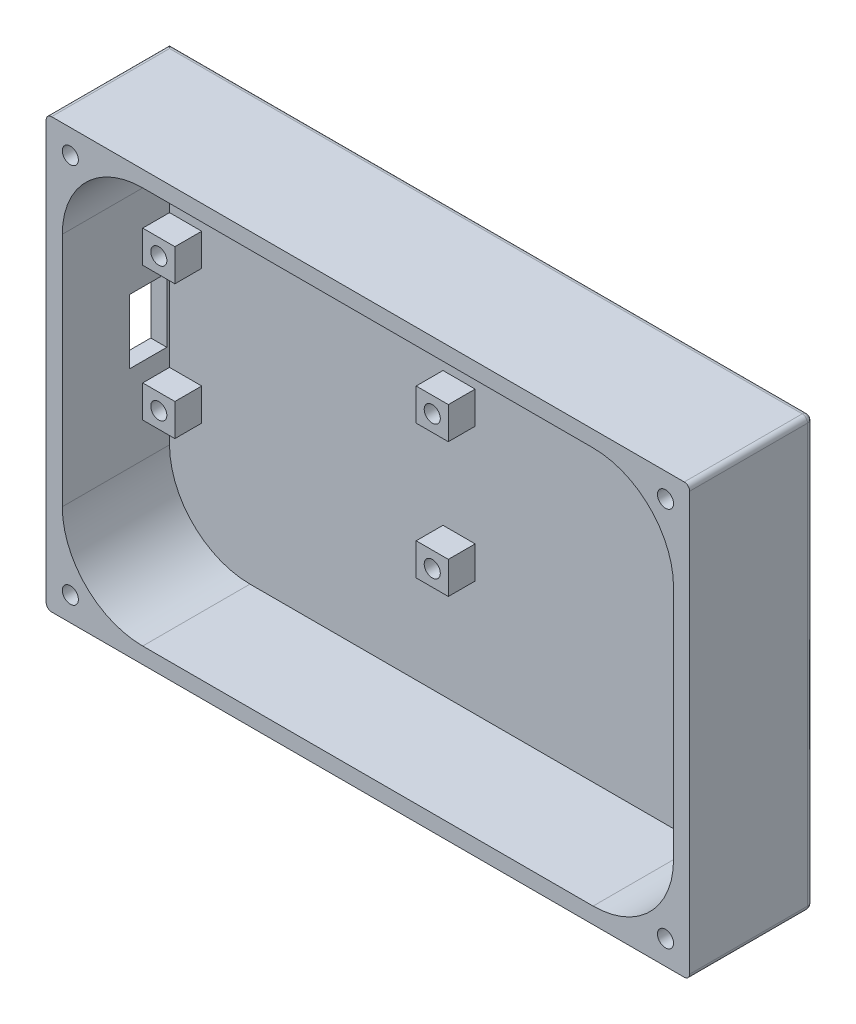
from build123d import *

# Parameters (mm, degrees)
ESQUISSE1_W             = 120
ESQUISSE1_H             = 80
BOSS_EXTRU_1_DEPTH      = 3
ESQUISSE4_W             = 120
ESQUISSE4_H             = 80
ESQUISSE4_W_2           = 114
ESQUISSE4_H_2           = 74
BOSS_EXTRU_3_DEPTH      = 20
CONG_1_R                = 15
ESQUISSE5_R             = 1.5
ENL_V_MAT_EXTRU_1_DEPTH = 147.044513762
ESQUISSE7_R             = 3
ENL_V_MAT_EXTRU_3_DEPTH = 6
ESQUISSE8_W             = 6
ESQUISSE8_H             = 6
ESQUISSE8_R             = 1.5
BOSS_EXTRU_4_DEPTH      = 5
ENL_V_MAT_EXTRU_4_REACH = 148.045
ESQUISSE9_W             = 7
ESQUISSE9_H             = 12
CONG_3_R                = 1


with BuildPart() as part:
    # Esquisse1 → Boss.-Extru.1 (new body)
    with BuildSketch(Plane.XY):
        with Locations((60, 40)):
            Rectangle(ESQUISSE1_W, ESQUISSE1_H)
    extrude(amount=BOSS_EXTRU_1_DEPTH)

    # Esquisse4 → Boss.-Extru.3 (add)
    with BuildSketch(Plane.XY.offset(3)):
        with Locations((60, 40)):
            Rectangle(ESQUISSE4_W, ESQUISSE4_H)
        with Locations((60, 40)):
            Rectangle(ESQUISSE4_W_2, ESQUISSE4_H_2, mode=Mode.SUBTRACT)
    extrude(amount=BOSS_EXTRU_3_DEPTH)

    # Congé1
    cong_1_edges = [part.edges().sort_by_distance(p)[0] for p in [
        (3, 3, 13),
        (117, 3, 13),
        (117, 77, 13),
        (3, 77, 13),
    ]]
    fillet(cong_1_edges, radius=CONG_1_R)

    # Esquisse5 → Enlèv. mat.-Extru.1 (cut, through all)
    with BuildSketch(Plane.XY.offset(23)):
        with Locations((4.5, 75.5)):
            Circle(ESQUISSE5_R)
        with Locations((115.5, 75.5)):
            Circle(ESQUISSE5_R)
        with Locations((115.5, 4.5)):
            Circle(ESQUISSE5_R)
        with Locations((4.5, 4.5)):
            Circle(ESQUISSE5_R)
    extrude(amount=-ENL_V_MAT_EXTRU_1_DEPTH, mode=Mode.SUBTRACT)

    # Esquisse7 → Enlèv. mat.-Extru.3 (cut)
    with BuildSketch(Plane(origin=(0, 0, 0), x_dir=(-1, 0, 0), z_dir=(0, 0, -1))):
        with Locations((-115.5, 75.5)):
            Circle(ESQUISSE7_R)
        with Locations((-4.5, 75.5)):
            Circle(ESQUISSE7_R)
        with Locations((-4.5, 4.5)):
            Circle(ESQUISSE7_R)
        with Locations((-115.5, 4.5)):
            Circle(ESQUISSE7_R)
    extrude(amount=-ENL_V_MAT_EXTRU_3_DEPTH, mode=Mode.SUBTRACT)

    # Esquisse8 → Boss.-Extru.4 (add)
    # profile 1 of 4: a face of its own
    with BuildSketch(Plane.XY.offset(3)):
        with Locations((6, 52.5)):
            Rectangle(ESQUISSE8_W, ESQUISSE8_H)
        with Locations((6, 52.5)):
            Circle(ESQUISSE8_R, mode=Mode.SUBTRACT)
    # profile 2 of 4: a face of its own
    with BuildSketch(Plane.XY.offset(3)):
        with Locations((57, 52.5)):
            Rectangle(ESQUISSE8_W, ESQUISSE8_H)
        with Locations((57, 52.5)):
            Circle(ESQUISSE8_R, mode=Mode.SUBTRACT)
    # profile 3 of 4: a face of its own
    with BuildSketch(Plane.XY.offset(3)):
        with Locations((57, 27.5)):
            Rectangle(ESQUISSE8_W, ESQUISSE8_H)
        with Locations((57, 27.5)):
            Circle(ESQUISSE8_R, mode=Mode.SUBTRACT)
    # profile 4 of 4: a face of its own
    with BuildSketch(Plane.XY.offset(3)):
        with Locations((6, 27.5)):
            Rectangle(ESQUISSE8_W, ESQUISSE8_H)
        with Locations((6, 27.5)):
            Circle(ESQUISSE8_R, mode=Mode.SUBTRACT)
    extrude(amount=BOSS_EXTRU_4_DEPTH)

    # Esquisse9 → Enlèv. mat.-Extru.4 (cut, up to next)
    with BuildSketch(Plane.ZY, mode=Mode.PRIVATE) as enl_v_mat_extru_4_sk1:
        with Locations((7, 40)):
            Rectangle(ESQUISSE9_W, ESQUISSE9_H)
    enl_v_mat_extru_4_tool1 = extrude(enl_v_mat_extru_4_sk1.sketch, amount=-ENL_V_MAT_EXTRU_4_REACH, mode=Mode.PRIVATE) & part.part
    add(enl_v_mat_extru_4_tool1.solids().sort_by_distance((0, 40, 7))[0], mode=Mode.SUBTRACT)

    # Congé3
    cong_3_edges = [part.edges().sort_by_distance(p)[0] for p in [
        (60, 80, 0),
        (120, 40, 0),
        (60, 0, 0),
        (0, 80, 11.5),
        (120, 80, 11.5),
        (120, 0, 11.5),
        (0, 0, 11.5),
    ]]
    fillet(cong_3_edges, radius=CONG_3_R)


solid = part.part
